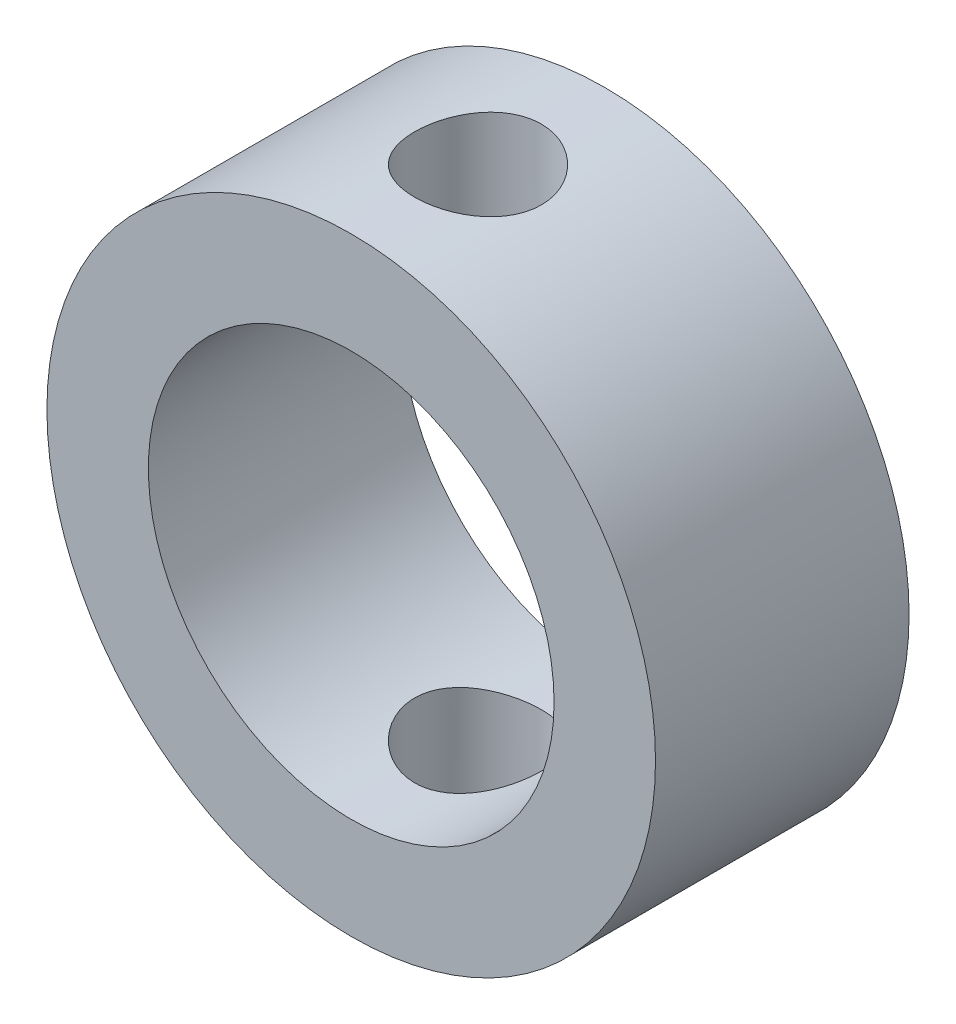
from build123d import *

# Parameters (mm, degrees)
SKETCH_1_R                      = 6
SKETCH_1_R_2                    = 4
EXTRUDE_1_DEPTH                 = 5
CUT_EXTRUDE_1_REACH             = 11.849
SKETCH_2_R                      = 1.25
CUT_EXTRUDE_1_DIRECTION_2_REACH = 11.849


with BuildPart() as part:
    # 草图1 → 凸台-拉伸1 (new body)
    with BuildSketch(Plane.XY):
        Circle(SKETCH_1_R)
        Circle(SKETCH_1_R_2, mode=Mode.SUBTRACT)
    extrude(amount=EXTRUDE_1_DEPTH)

    # 草图2 → 切除-拉伸1 (cut, up to next)
    with BuildSketch(Plane(origin=(0, 0, 0), x_dir=(1, 0, 0), z_dir=(0, 1, 0)), mode=Mode.PRIVATE) as cut_extrude_1_sk1:
        with Locations(Location((0, -2.5, 0), (0, 0, 270))):
            Circle(SKETCH_2_R)
    cut_extrude_1_tool1 = extrude(cut_extrude_1_sk1.sketch, amount=-CUT_EXTRUDE_1_REACH, mode=Mode.PRIVATE) & part.part
    add(cut_extrude_1_tool1.solids().sort_by_distance((0, 0, 2.5))[0], mode=Mode.SUBTRACT)

    # 草图2 → 切除-拉伸1 direction 2 (cut, up to next)
    with BuildSketch(Plane(origin=(0, 0, 0), x_dir=(1, 0, 0), z_dir=(0, 1, 0)), mode=Mode.PRIVATE) as cut_extrude_1_direction_2_sk1:
        with Locations(Location((0, -2.5, 0), (0, 0, 270))):
            Circle(SKETCH_2_R)
    cut_extrude_1_direction_2_tool1 = extrude(cut_extrude_1_direction_2_sk1.sketch, amount=CUT_EXTRUDE_1_DIRECTION_2_REACH, mode=Mode.PRIVATE) & part.part
    add(cut_extrude_1_direction_2_tool1.solids().sort_by_distance((0, 0, 2.5))[0], mode=Mode.SUBTRACT)


solid = part.part
